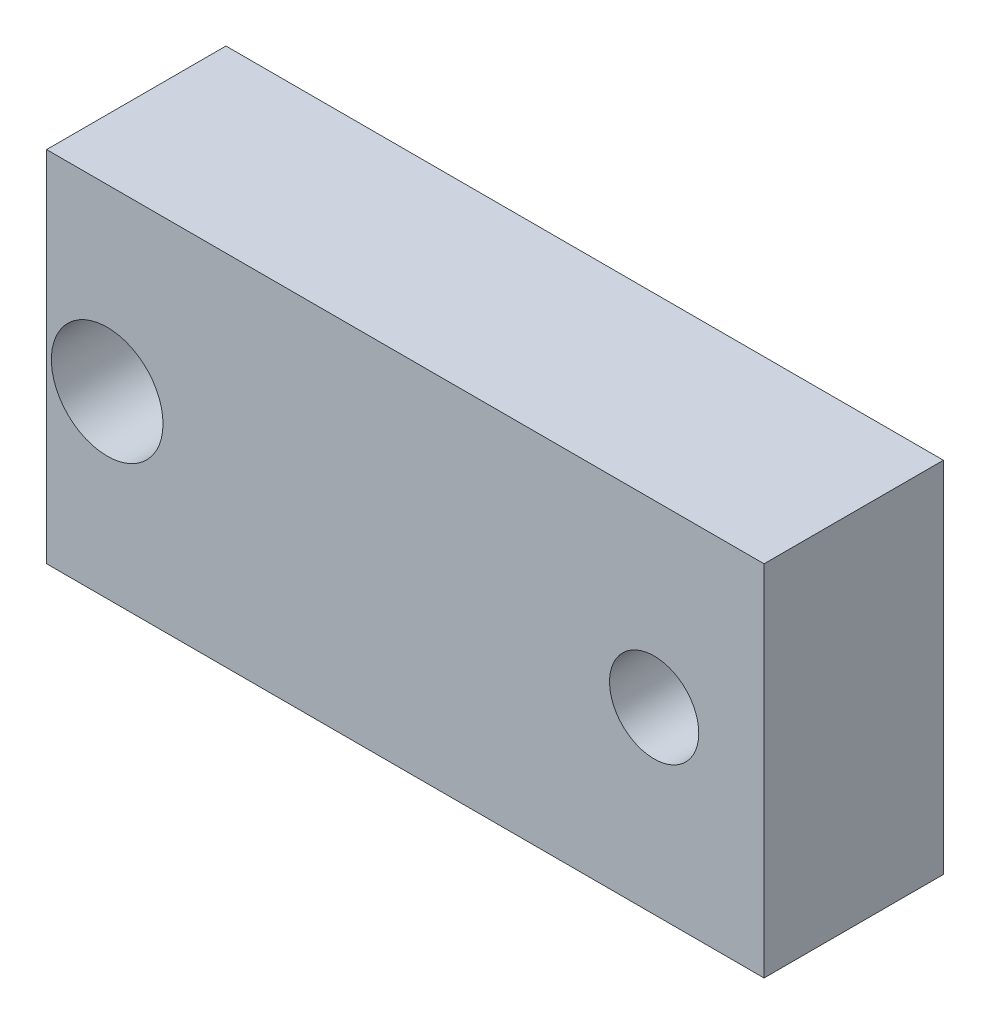
from build123d import *

# Parameters (mm, degrees)
SKETCH1_W           = 25.4
SKETCH1_H           = 12.7
SKETCH1_R           = 1.976131374
SKETCH1_R_2         = 1.579319973
BOSS_EXTRUDE1_DEPTH = 6.35


with BuildPart() as part:
    # Sketch1 → Boss-Extrude1 (new body)
    with BuildSketch(Plane.XY):
        Rectangle(SKETCH1_W, SKETCH1_H)
        with Locations((-10.555183251, 0)):
            Circle(SKETCH1_R, mode=Mode.SUBTRACT)
        with Locations((8.809213089, 0)):
            Circle(SKETCH1_R_2, mode=Mode.SUBTRACT)
    extrude(amount=BOSS_EXTRUDE1_DEPTH)


solid = part.part
